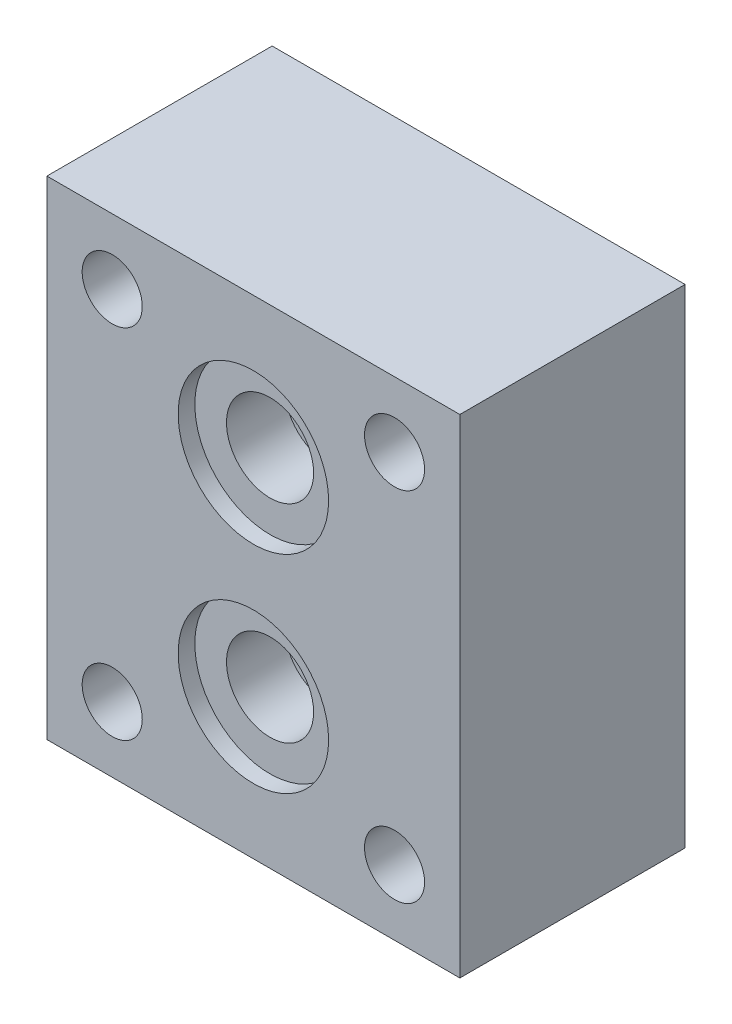
from build123d import *

# Parameters (mm, degrees)
SKETCH1_W           = 82.55
SKETCH1_H           = 69.85
BOSS_EXTRUDE1_DEPTH = 19.05
CUT_EXTRUDE2_START  = 19.05
SKETCH2_R           = 5.08
CUT_EXTRUDE2_DEPTH  = 77.376117521
CUT_EXTRUDE4_START  = 19.05
SKETCH3_R           = 7.366
CUT_EXTRUDE4_DEPTH  = 12.7
CUT_EXTRUDE6_START  = 19.05
SKETCH4_R           = 12.7254
CUT_EXTRUDE6_DEPTH  = 2.8194


with BuildPart() as part:
    # Sketch1 → Boss-Extrude1 (new, symmetric)
    with BuildSketch(Plane(origin=(0, 0, 0), x_dir=(0, 1, 0), z_dir=(0, 0, 1))):
        Rectangle(SKETCH1_W, SKETCH1_H)
    extrude(amount=BOSS_EXTRUDE1_DEPTH, both=True)

    # Sketch2 → Cut-Extrude2 (cut, through all)
    with BuildSketch(Plane(origin=(0, 0, 0), x_dir=(0, 1, 0), z_dir=(0, 0, 1)).offset(CUT_EXTRUDE2_START)):
        with Locations(Location((-30.226, -23.876, 0), (0, 0, 270))):
            Circle(SKETCH2_R)
        with Locations(Location((30.226, -23.876, 0), (0, 0, 270))):
            Circle(SKETCH2_R)
        with Locations(Location((-30.226, 23.876, 0), (0, 0, 270))):
            Circle(SKETCH2_R)
        with Locations(Location((30.226, 23.876, 0), (0, 0, 270))):
            Circle(SKETCH2_R)
    extrude(amount=-CUT_EXTRUDE2_DEPTH, mode=Mode.SUBTRACT)

    # Sketch3 → Cut-Extrude4 (cut)
    with BuildSketch(Plane(origin=(0, 0, 0), x_dir=(0, 1, 0), z_dir=(0, 0, 1)).offset(CUT_EXTRUDE4_START)):
        with Locations(Location((-17.526, 0, 0), (0, 0, 270))):
            Circle(SKETCH3_R)
        with Locations(Location((17.526, 0, 0), (0, 0, 270))):
            Circle(SKETCH3_R)
    extrude(amount=-CUT_EXTRUDE4_DEPTH, mode=Mode.SUBTRACT)

    # Sketch4 → Cut-Extrude6 (cut)
    with BuildSketch(Plane(origin=(0, 0, 0), x_dir=(0, 1, 0), z_dir=(0, 0, 1)).offset(CUT_EXTRUDE6_START)):
        with Locations(Location((-17.526, 0, 0), (0, 0, 270))):
            Circle(SKETCH4_R)
        with Locations(Location((17.526, 0, 0), (0, 0, 270))):
            Circle(SKETCH4_R)
    extrude(amount=-CUT_EXTRUDE6_DEPTH, mode=Mode.SUBTRACT)


solid = part.part
